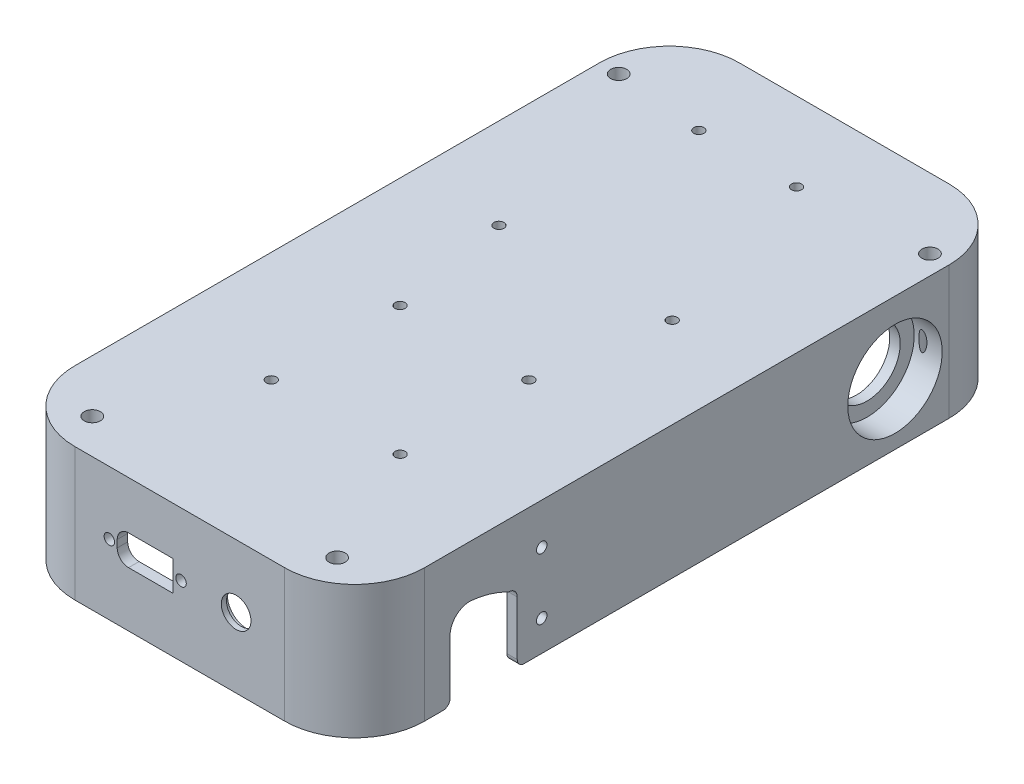
from build123d import *

# Parameters (mm, degrees)
SKETCH1_R               = 2.3
SKETCH1_R_2             = 1.45
BOSS_EXTRUDE1_DEPTH     = 3
BOSS_EXTRUDE2_START     = -35
SKETCH1_3_R             = 2.3
BOSS_EXTRUDE2_DEPTH     = 35
CUT_EXTRUDE1_DEPTH      = 218.543099178
CUT_EXTRUDE1_DEPTH_BACK = 218.543099178
SKETCH2_R               = 1.5
SKETCH2_R_2             = 9.5
SKETCH2_5_R             = 13.5
SKETCH2_5_R_2           = 9.5
CUT_EXTRUDE2_DEPTH      = 8
CUT_EXTRUDE3_START      = -92
SKETCH2_6_R             = 13.5
SKETCH2_6_R_2           = 9.5
CUT_EXTRUDE3_DEPTH      = 8
CUT_EXTRUDE4_REACH      = 219.543
SKETCH3_R               = 8.5
FILLET2_R               = 5
BOSS_EXTRUDE3_START     = -3.5
SKETCH1_7_R             = 2.25
SKETCH1_7_R_2           = 1.45
BOSS_EXTRUDE3_DEPTH     = 3.5
FILLET3_R               = 2
CUT_EXTRUDE5_REACH      = 219.543
SKETCH4_R               = 1.5
SKETCH4_R_2             = 4.25
CUT_EXTRUDE6_START      = -1.5
SKETCH4_5_R             = 5.5
SKETCH4_5_R_2           = 4.25
CUT_EXTRUDE6_DEPTH      = 1.5
CUT_EXTRUDE7_START      = -3
SKETCH2_8_W             = 4.5
SKETCH2_8_H             = 21.1
CUT_EXTRUDE7_DEPTH      = 1.5
CUT_EXTRUDE8_START      = -97
SKETCH2_9_W             = 4.5
SKETCH2_9_H             = 21.1
CUT_EXTRUDE8_DEPTH      = 1.5


with BuildPart() as part:
    # Sketch1 → Boss-Extrude1 (new body)
    with BuildSketch(Plane(origin=(0, 0, 0), x_dir=(1, 0, 0), z_dir=(0, 1, 0))):
        with BuildLine():
            Line((0, 170), (0, 20))
            ThreePointArc((0, 20), (5.857864376, 5.857864376), (20, 0))
            Line((20, 0), (80, 0))
            ThreePointArc((80, 0), (94.142135624, 5.857864376), (100, 20))
            Line((100, 20), (100, 170))
            ThreePointArc((100, 170), (94.142135624, 184.142135624), (80, 190))
            Line((80, 190), (20, 190))
            ThreePointArc((20, 190), (5.857864376, 184.142135624), (0, 170))
        make_face()
        with Locations(Location((5.5, 170, 0), (0, 0, 270))):
            Circle(SKETCH1_R, mode=Mode.SUBTRACT)
        with Locations(Location((94.5, 170, 0), (0, 0, 270))):
            Circle(SKETCH1_R, mode=Mode.SUBTRACT)
        with Locations(Location((15, 10, 0), (0, 0, 270))):
            Circle(SKETCH1_R, mode=Mode.SUBTRACT)
        with Locations(Location((85, 10, 0), (0, 0, 270))):
            Circle(SKETCH1_R, mode=Mode.SUBTRACT)
        with Locations(Location((31.5875, 81.4125, 0), (0, 0, 270))):
            Circle(SKETCH1_R_2, mode=Mode.SUBTRACT)
        with Locations(Location((68.4125, 81.4125, 0), (0, 0, 270))):
            Circle(SKETCH1_R_2, mode=Mode.SUBTRACT)
        with Locations(Location((68.4125, 44.5875, 0), (0, 0, 270))):
            Circle(SKETCH1_R_2, mode=Mode.SUBTRACT)
        with Locations(Location((31.5875, 44.5875, 0), (0, 0, 270))):
            Circle(SKETCH1_R_2, mode=Mode.SUBTRACT)
        with Locations(Location((74.13, 116.66, 0), (0, 0, 270))):
            Circle(SKETCH1_R_2, mode=Mode.SUBTRACT)
        with Locations(Location((25.87, 115.39, 0), (0, 0, 270))):
            Circle(SKETCH1_R_2, mode=Mode.SUBTRACT)
        with Locations(Location((30.95, 167.46, 0), (0, 0, 270))):
            Circle(SKETCH1_R_2, mode=Mode.SUBTRACT)
        with Locations(Location((58.89, 167.46, 0), (0, 0, 270))):
            Circle(SKETCH1_R_2, mode=Mode.SUBTRACT)
    extrude(amount=BOSS_EXTRUDE1_DEPTH)

    # Sketch1<3> → Boss-Extrude2 (add)
    # profile 1 of 3: a face of its own
    with BuildSketch(Plane(origin=(0, 0, 0), x_dir=(1, 0, 0), z_dir=(0, 1, 0)).offset(BOSS_EXTRUDE2_START)):
        with BuildLine():
            ThreePointArc((0, 170), (5.857864376, 184.142135624), (20, 190))
            Line((20, 190), (80, 190))
            ThreePointArc((80, 190), (94.142135624, 184.142135624), (100, 170))
            Line((100, 170), (100, 20))
            ThreePointArc((100, 20), (94.142135624, 5.857864376), (80, 0))
            Line((80, 0), (50, 0))
            Line((50, 0), (20, 0))
            ThreePointArc((20, 0), (5.857864376, 5.857864376), (0, 20))
            Line((0, 20), (0, 170))
        make_face()
        with Locations(Location((5.5, 170, 0), (0, 0, 270))):
            Circle(SKETCH1_3_R, mode=Mode.SUBTRACT)
        with Locations(Location((94.5, 170, 0), (0, 0, 270))):
            Circle(SKETCH1_3_R, mode=Mode.SUBTRACT)
        with BuildLine():
            Line((23, 3), (77, 3))
            ThreePointArc((77, 3), (91.142135624, 8.857864376), (97, 23))
            Line((97, 23), (97, 90))
            Line((97, 90), (89, 130))
            Line((89, 130), (89, 185))
            Line((89, 185), (11, 185))
            Line((11, 185), (11, 130))
            Line((11, 130), (3, 90))
            Line((3, 90), (3, 23))
            ThreePointArc((3, 23), (8.857864376, 8.857864376), (23, 3))
        make_face(mode=Mode.SUBTRACT)
    # profile 2 of 3: a face of its own
    with BuildSketch(Plane(origin=(0, 0, 0), x_dir=(1, 0, 0), z_dir=(0, 1, 0)).offset(BOSS_EXTRUDE2_START)):
        with BuildLine():
            Line((15, 15), (4.66969722, 15))
            ThreePointArc((4.66969722, 15), (10.818022556, 7.13811406), (20, 3.226280067))
            Line((20, 3.226280067), (20, 10))
            ThreePointArc((20, 10), (18.535533906, 13.535533906), (15, 15))
        make_face()
        with Locations(Location((15, 10, 0), (0, 0, 270))):
            Circle(SKETCH1_3_R, mode=Mode.SUBTRACT)
    # profile 3 of 3: a face of its own
    with BuildSketch(Plane(origin=(0, 0, 0), x_dir=(1, 0, 0), z_dir=(0, 1, 0)).offset(BOSS_EXTRUDE2_START)):
        with BuildLine():
            Line((80, 10), (80, 3.226280067))
            ThreePointArc((80, 3.226280067), (89.181977444, 7.13811406), (95.33030278, 15))
            Line((95.33030278, 15), (85, 15))
            ThreePointArc((85, 15), (81.464466094, 13.535533906), (80, 10))
        make_face()
        with Locations(Location((85, 10, 0), (0, 0, 270))):
            Circle(SKETCH1_3_R, mode=Mode.SUBTRACT)
    extrude(amount=BOSS_EXTRUDE2_DEPTH)

    # Sketch2 → Cut-Extrude1 (cut, two sides: drawn at the far end of the back side and taken through both)
    with BuildSketch(Plane.ZY.offset(-CUT_EXTRUDE1_DEPTH_BACK)):
        with BuildLine():
            Line((-46.5, -17.5), (-46.5, -35))
            Line((-46.5, -35), (-27.285, -35))
            Line((-27.285, -35), (-27.285, -17.5))
            ThreePointArc((-27.285, -17.5), (-28.958884746, -13.458884746), (-33, -11.785))
            add(Edge.make_bspline(
                [(-33, -11.785), (-38.661222304, -12.266190364), (-44, -15)],
                knots=[0.625917794, 0.625917794, 0.625917794, 1.326576977, 1.326576977, 1.326576977], degree=2))
            ThreePointArc((-44, -15), (-45.767766953, -15.732233047), (-46.5, -17.5))
        make_face()
        with Locations((-53.5, -8.75)):
            Circle(SKETCH2_R)
        with Locations((-53.5, -26.25)):
            Circle(SKETCH2_R)
        with Locations((-154.5, -17.5)):
            Circle(SKETCH2_R_2)
    extrude(amount=CUT_EXTRUDE1_DEPTH + CUT_EXTRUDE1_DEPTH_BACK, mode=Mode.SUBTRACT)

    # Sketch2<5> → Cut-Extrude2 (cut)
    with BuildSketch(Plane.ZY):
        with Locations((-154.5, -17.5)):
            Circle(SKETCH2_5_R)
        with Locations((-154.5, -17.5)):
            Circle(SKETCH2_5_R_2, mode=Mode.SUBTRACT)
    extrude(amount=-CUT_EXTRUDE2_DEPTH, mode=Mode.SUBTRACT)

    # Sketch2<6> → Cut-Extrude3 (cut)
    with BuildSketch(Plane.ZY.offset(CUT_EXTRUDE3_START)):
        with Locations((-154.5, -17.5)):
            Circle(SKETCH2_6_R)
        with Locations((-154.5, -17.5)):
            Circle(SKETCH2_6_R_2, mode=Mode.SUBTRACT)
    extrude(amount=-CUT_EXTRUDE3_DEPTH, mode=Mode.SUBTRACT)

    # Sketch3 → Cut-Extrude4 (cut, up to next)
    with BuildSketch(Plane(origin=(0, 0, -190), x_dir=(-1, 0, 0), z_dir=(0, 0, -1)), mode=Mode.PRIVATE) as cut_extrude4_sk1:
        with Locations((-36.35, -15)):
            Circle(SKETCH3_R)
    cut_extrude4_tool1 = extrude(cut_extrude4_sk1.sketch, amount=-CUT_EXTRUDE4_REACH, mode=Mode.PRIVATE) & part.part
    # Sketch3 → Cut-Extrude4 (cut, up to next)
    with BuildSketch(Plane(origin=(0, 0, -190), x_dir=(-1, 0, 0), z_dir=(0, 0, -1)), mode=Mode.PRIVATE) as cut_extrude4_sk2:
        with Locations((-63.65, -15)):
            Circle(SKETCH3_R)
    cut_extrude4_tool2 = extrude(cut_extrude4_sk2.sketch, amount=-CUT_EXTRUDE4_REACH, mode=Mode.PRIVATE) & part.part
    add(cut_extrude4_tool1.solids().sort_by_distance((36.35, -15, -190))[0], mode=Mode.SUBTRACT)
    add(cut_extrude4_tool2.solids().sort_by_distance((63.65, -15, -190))[0], mode=Mode.SUBTRACT)

    # Fillet2
    fillet2_edges = [part.edges().sort_by_distance(p)[0] for p in [
        (89, -17.5, -185),
        (11, -17.5, -185),
    ]]
    fillet(fillet2_edges, radius=FILLET2_R)

    # Sketch1<7> → Boss-Extrude3 (add)
    # profile 1 of 8: a face of its own
    with BuildSketch(Plane(origin=(0, 0, 0), x_dir=(1, 0, 0), z_dir=(0, 1, 0)).offset(BOSS_EXTRUDE3_START)):
        with Locations(Location((31.5875, 81.4125, 0), (0, 0, 270))):
            Circle(SKETCH1_7_R)
        with Locations(Location((31.5875, 81.4125, 0), (0, 0, 270))):
            Circle(SKETCH1_7_R_2, mode=Mode.SUBTRACT)
    # profile 2 of 8: a face of its own
    with BuildSketch(Plane(origin=(0, 0, 0), x_dir=(1, 0, 0), z_dir=(0, 1, 0)).offset(BOSS_EXTRUDE3_START)):
        with Locations(Location((31.5875, 44.5875, 0), (0, 0, 270))):
            Circle(SKETCH1_7_R)
        with Locations(Location((31.5875, 44.5875, 0), (0, 0, 270))):
            Circle(SKETCH1_7_R_2, mode=Mode.SUBTRACT)
    # profile 3 of 8: a face of its own
    with BuildSketch(Plane(origin=(0, 0, 0), x_dir=(1, 0, 0), z_dir=(0, 1, 0)).offset(BOSS_EXTRUDE3_START)):
        with Locations(Location((68.4125, 44.5875, 0), (0, 0, 270))):
            Circle(SKETCH1_7_R)
        with Locations(Location((68.4125, 44.5875, 0), (0, 0, 270))):
            Circle(SKETCH1_7_R_2, mode=Mode.SUBTRACT)
    # profile 4 of 8: a face of its own
    with BuildSketch(Plane(origin=(0, 0, 0), x_dir=(1, 0, 0), z_dir=(0, 1, 0)).offset(BOSS_EXTRUDE3_START)):
        with Locations(Location((68.4125, 81.4125, 0), (0, 0, 270))):
            Circle(SKETCH1_7_R)
        with Locations(Location((68.4125, 81.4125, 0), (0, 0, 270))):
            Circle(SKETCH1_7_R_2, mode=Mode.SUBTRACT)
    # profile 5 of 8: a face of its own
    with BuildSketch(Plane(origin=(0, 0, 0), x_dir=(1, 0, 0), z_dir=(0, 1, 0)).offset(BOSS_EXTRUDE3_START)):
        with Locations(Location((58.89, 167.46, 0), (0, 0, 270))):
            Circle(SKETCH1_7_R)
        with Locations(Location((58.89, 167.46, 0), (0, 0, 270))):
            Circle(SKETCH1_7_R_2, mode=Mode.SUBTRACT)
    # profile 6 of 8: a face of its own
    with BuildSketch(Plane(origin=(0, 0, 0), x_dir=(1, 0, 0), z_dir=(0, 1, 0)).offset(BOSS_EXTRUDE3_START)):
        with Locations(Location((30.95, 167.46, 0), (0, 0, 270))):
            Circle(SKETCH1_7_R)
        with Locations(Location((30.95, 167.46, 0), (0, 0, 270))):
            Circle(SKETCH1_7_R_2, mode=Mode.SUBTRACT)
    # profile 7 of 8: a face of its own
    with BuildSketch(Plane(origin=(0, 0, 0), x_dir=(1, 0, 0), z_dir=(0, 1, 0)).offset(BOSS_EXTRUDE3_START)):
        with Locations(Location((25.87, 115.39, 0), (0, 0, 270))):
            Circle(SKETCH1_7_R)
        with Locations(Location((25.87, 115.39, 0), (0, 0, 270))):
            Circle(SKETCH1_7_R_2, mode=Mode.SUBTRACT)
    # profile 8 of 8: a face of its own
    with BuildSketch(Plane(origin=(0, 0, 0), x_dir=(1, 0, 0), z_dir=(0, 1, 0)).offset(BOSS_EXTRUDE3_START)):
        with Locations(Location((74.13, 116.66, 0), (0, 0, 270))):
            Circle(SKETCH1_7_R)
        with Locations(Location((74.13, 116.66, 0), (0, 0, 270))):
            Circle(SKETCH1_7_R_2, mode=Mode.SUBTRACT)
    extrude(amount=BOSS_EXTRUDE3_DEPTH)

    # Fillet3
    fillet3_edges = [part.edges().sort_by_distance(p)[0] for p in [
        (1.5, -35, -46.5),
        (1.5, -35, -27.285),
        (98.5, -35, -27.285),
        (98.5, -35, -46.5),
        (31.5875, 0, -83.6625),
        (31.5875, 0, -46.8375),
        (68.4125, 0, -46.8375),
        (68.4125, 0, -83.6625),
        (58.89, 0, -169.71),
        (30.95, 0, -169.71),
        (25.87, 0, -117.64),
        (74.13, 0, -118.91),
    ]]
    fillet(fillet3_edges, radius=FILLET3_R)

    # Sketch4 → Cut-Extrude5 (cut, up to next)
    with BuildSketch(Plane.XY, mode=Mode.PRIVATE) as cut_extrude5_sk1:
        with BuildLine():
            ThreePointArc((35.375, -19.3), (33.076902961, -18.348097039), (32.125, -16.05))
            Line((32.125, -16.05), (32.125, -13.95))
            ThreePointArc((32.125, -13.95), (33.076902961, -11.651902961), (35.375, -10.7))
            Line((35.375, -10.7), (48.125, -10.7))
            Line((48.125, -10.7), (48.125, -19.3))
            Line((48.125, -19.3), (35.375, -19.3))
        make_face()
    cut_extrude5_tool1 = extrude(cut_extrude5_sk1.sketch, amount=-CUT_EXTRUDE5_REACH, mode=Mode.PRIVATE) & part.part
    # Sketch4 → Cut-Extrude5 (cut, up to next)
    with BuildSketch(Plane.XY, mode=Mode.PRIVATE) as cut_extrude5_sk2:
        with Locations((29.875, -15)):
            Circle(SKETCH4_R)
    cut_extrude5_tool2 = extrude(cut_extrude5_sk2.sketch, amount=-CUT_EXTRUDE5_REACH, mode=Mode.PRIVATE) & part.part
    # Sketch4 → Cut-Extrude5 (cut, up to next)
    with BuildSketch(Plane.XY, mode=Mode.PRIVATE) as cut_extrude5_sk3:
        with Locations((50.375, -15)):
            Circle(SKETCH4_R)
    cut_extrude5_tool3 = extrude(cut_extrude5_sk3.sketch, amount=-CUT_EXTRUDE5_REACH, mode=Mode.PRIVATE) & part.part
    # Sketch4 → Cut-Extrude5 (cut, up to next)
    with BuildSketch(Plane.XY, mode=Mode.PRIVATE) as cut_extrude5_sk4:
        with Locations((66.125, -15)):
            Circle(SKETCH4_R_2)
    cut_extrude5_tool4 = extrude(cut_extrude5_sk4.sketch, amount=-CUT_EXTRUDE5_REACH, mode=Mode.PRIVATE) & part.part
    add(cut_extrude5_tool1.solids().sort_by_distance((40.372821, -15, 0))[0], mode=Mode.SUBTRACT)
    add(cut_extrude5_tool2.solids().sort_by_distance((29.875, -15, 0))[0], mode=Mode.SUBTRACT)
    add(cut_extrude5_tool3.solids().sort_by_distance((50.375, -15, 0))[0], mode=Mode.SUBTRACT)
    add(cut_extrude5_tool4.solids().sort_by_distance((66.125, -15, 0))[0], mode=Mode.SUBTRACT)

    # Sketch4<5> → Cut-Extrude6 (cut)
    with BuildSketch(Plane.XY.offset(CUT_EXTRUDE6_START)):
        with Locations((66.125, -15)):
            Circle(SKETCH4_5_R)
        with Locations((66.125, -15)):
            Circle(SKETCH4_5_R_2, mode=Mode.SUBTRACT)
    extrude(amount=-CUT_EXTRUDE6_DEPTH, mode=Mode.SUBTRACT)

    # Sketch2<8> → Cut-Extrude7 (cut)
    with BuildSketch(Plane.ZY.offset(CUT_EXTRUDE7_START)):
        with Locations((-64.75, -24.45)):
            Rectangle(SKETCH2_8_W, SKETCH2_8_H)
    extrude(amount=CUT_EXTRUDE7_DEPTH, mode=Mode.SUBTRACT)

    # Sketch2<9> → Cut-Extrude8 (cut)
    with BuildSketch(Plane.ZY.offset(CUT_EXTRUDE8_START)):
        with Locations((-64.75, -24.45)):
            Rectangle(SKETCH2_9_W, SKETCH2_9_H)
    extrude(amount=-CUT_EXTRUDE8_DEPTH, mode=Mode.SUBTRACT)


solid = part.part
